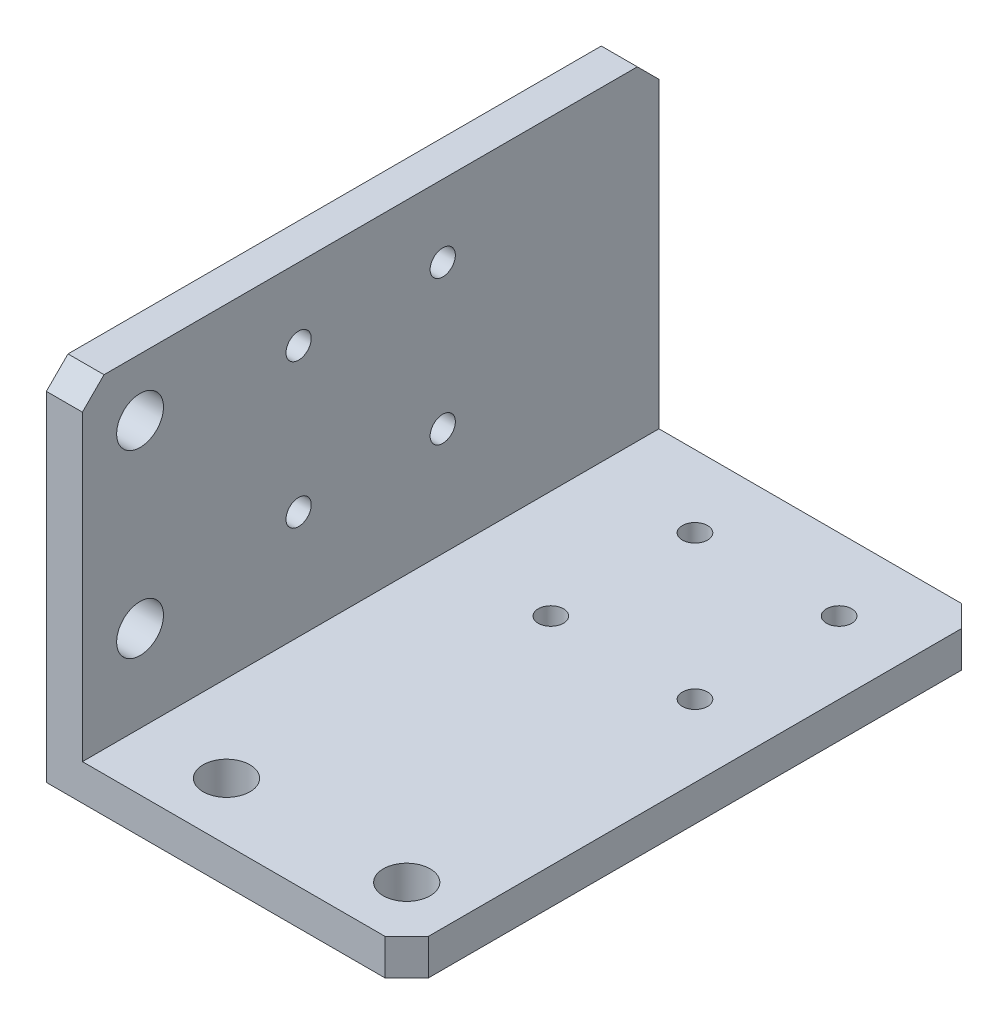
from build123d import *

# Parameters (mm, degrees)
ESTRUSIONE_ESTRUSIONE1_DEPTH = 80
FORO_6_5_6_5_1_D             = 6.5
FORO_6_5_6_5_2_D             = 6.5
FORO_6_5_6_5_2_DEPTH         = 5
FORO_6_5_6_5_2_TIP           = 1.952797012
TAGLIO_ESTRUSIONE1_REACH     = 108.771
SCHIZZO8_R                   = 1.75
TAGLIO_ESTRUSIONE2_REACH     = 108.771
SCHIZZO9_R                   = 1.75
SMUSSO1_SIZE                 = 3


with BuildPart() as part:
    # Schizzo1 → Estrusione-Estrusione1 (new body)
    with BuildSketch(Plane.XY):
        Polygon((0, 0), (0, 50), (5, 50), (5, 5), (50, 5), (50, 0), align=None)
    extrude(amount=ESTRUSIONE_ESTRUSIONE1_DEPTH)

    # Foro Ø6.5 (6.5)-1 (through all)
    with Locations(Plane(origin=(0, 0, 0), x_dir=(-1, 0, 0), z_dir=(0, -1, 0))):
        with Locations((-17, -72), (-42, -72)):
            Hole(FORO_6_5_6_5_1_D / 2)

    # Foro Ø6.5 (6.5)-2
    with Locations(Plane.ZY):
        with Locations((72, 42), (72, 17)):
            Hole(FORO_6_5_6_5_2_D / 2, depth=FORO_6_5_6_5_2_DEPTH)
            with Locations((0, 0, -(FORO_6_5_6_5_2_DEPTH + FORO_6_5_6_5_2_TIP / 2))):  # 118° drill point
                Cone(0, FORO_6_5_6_5_2_D / 2, FORO_6_5_6_5_2_TIP, mode=Mode.SUBTRACT)

    # Schizzo8 → Taglio-Estrusione1 (cut, up to next)
    with BuildSketch(Plane.XZ, mode=Mode.PRIVATE) as taglio_estrusione1_sk1:
        with Locations((20, 10)):
            Circle(SCHIZZO8_R)
    taglio_estrusione1_tool1 = extrude(taglio_estrusione1_sk1.sketch, amount=-TAGLIO_ESTRUSIONE1_REACH, mode=Mode.PRIVATE) & part.part
    # Schizzo8 → Taglio-Estrusione1 (cut, up to next)
    with BuildSketch(Plane.XZ, mode=Mode.PRIVATE) as taglio_estrusione1_sk2:
        with Locations((20, 30)):
            Circle(SCHIZZO8_R)
    taglio_estrusione1_tool2 = extrude(taglio_estrusione1_sk2.sketch, amount=-TAGLIO_ESTRUSIONE1_REACH, mode=Mode.PRIVATE) & part.part
    # Schizzo8 → Taglio-Estrusione1 (cut, up to next)
    with BuildSketch(Plane.XZ, mode=Mode.PRIVATE) as taglio_estrusione1_sk3:
        with Locations((40, 30)):
            Circle(SCHIZZO8_R)
    taglio_estrusione1_tool3 = extrude(taglio_estrusione1_sk3.sketch, amount=-TAGLIO_ESTRUSIONE1_REACH, mode=Mode.PRIVATE) & part.part
    # Schizzo8 → Taglio-Estrusione1 (cut, up to next)
    with BuildSketch(Plane.XZ, mode=Mode.PRIVATE) as taglio_estrusione1_sk4:
        with Locations((40, 10)):
            Circle(SCHIZZO8_R)
    taglio_estrusione1_tool4 = extrude(taglio_estrusione1_sk4.sketch, amount=-TAGLIO_ESTRUSIONE1_REACH, mode=Mode.PRIVATE) & part.part
    add(taglio_estrusione1_tool1.solids().sort_by_distance((20, 0, 10))[0], mode=Mode.SUBTRACT)
    add(taglio_estrusione1_tool2.solids().sort_by_distance((20, 0, 30))[0], mode=Mode.SUBTRACT)
    add(taglio_estrusione1_tool3.solids().sort_by_distance((40, 0, 30))[0], mode=Mode.SUBTRACT)
    add(taglio_estrusione1_tool4.solids().sort_by_distance((40, 0, 10))[0], mode=Mode.SUBTRACT)

    # Schizzo9 → Taglio-Estrusione2 (cut, up to next)
    with BuildSketch(Plane.ZY, mode=Mode.PRIVATE) as taglio_estrusione2_sk1:
        with Locations((30, 40)):
            Circle(SCHIZZO9_R)
    taglio_estrusione2_tool1 = extrude(taglio_estrusione2_sk1.sketch, amount=-TAGLIO_ESTRUSIONE2_REACH, mode=Mode.PRIVATE) & part.part
    # Schizzo9 → Taglio-Estrusione2 (cut, up to next)
    with BuildSketch(Plane.ZY, mode=Mode.PRIVATE) as taglio_estrusione2_sk2:
        with Locations((50, 40)):
            Circle(SCHIZZO9_R)
    taglio_estrusione2_tool2 = extrude(taglio_estrusione2_sk2.sketch, amount=-TAGLIO_ESTRUSIONE2_REACH, mode=Mode.PRIVATE) & part.part
    # Schizzo9 → Taglio-Estrusione2 (cut, up to next)
    with BuildSketch(Plane.ZY, mode=Mode.PRIVATE) as taglio_estrusione2_sk3:
        with Locations((50, 20)):
            Circle(SCHIZZO9_R)
    taglio_estrusione2_tool3 = extrude(taglio_estrusione2_sk3.sketch, amount=-TAGLIO_ESTRUSIONE2_REACH, mode=Mode.PRIVATE) & part.part
    # Schizzo9 → Taglio-Estrusione2 (cut, up to next)
    with BuildSketch(Plane.ZY, mode=Mode.PRIVATE) as taglio_estrusione2_sk4:
        with Locations((30, 20)):
            Circle(SCHIZZO9_R)
    taglio_estrusione2_tool4 = extrude(taglio_estrusione2_sk4.sketch, amount=-TAGLIO_ESTRUSIONE2_REACH, mode=Mode.PRIVATE) & part.part
    add(taglio_estrusione2_tool1.solids().sort_by_distance((0, 40, 30))[0], mode=Mode.SUBTRACT)
    add(taglio_estrusione2_tool2.solids().sort_by_distance((0, 40, 50))[0], mode=Mode.SUBTRACT)
    add(taglio_estrusione2_tool3.solids().sort_by_distance((0, 20, 50))[0], mode=Mode.SUBTRACT)
    add(taglio_estrusione2_tool4.solids().sort_by_distance((0, 20, 30))[0], mode=Mode.SUBTRACT)

    # Smusso1
    smusso1_edges = [part.edges().sort_by_distance(p)[0] for p in [
        (2.5, 50, 80),
        (2.5, 50, 0),
        (50, 2.5, 80),
        (50, 2.5, 0),
    ]]
    chamfer(smusso1_edges, length=SMUSSO1_SIZE)


solid = part.part
